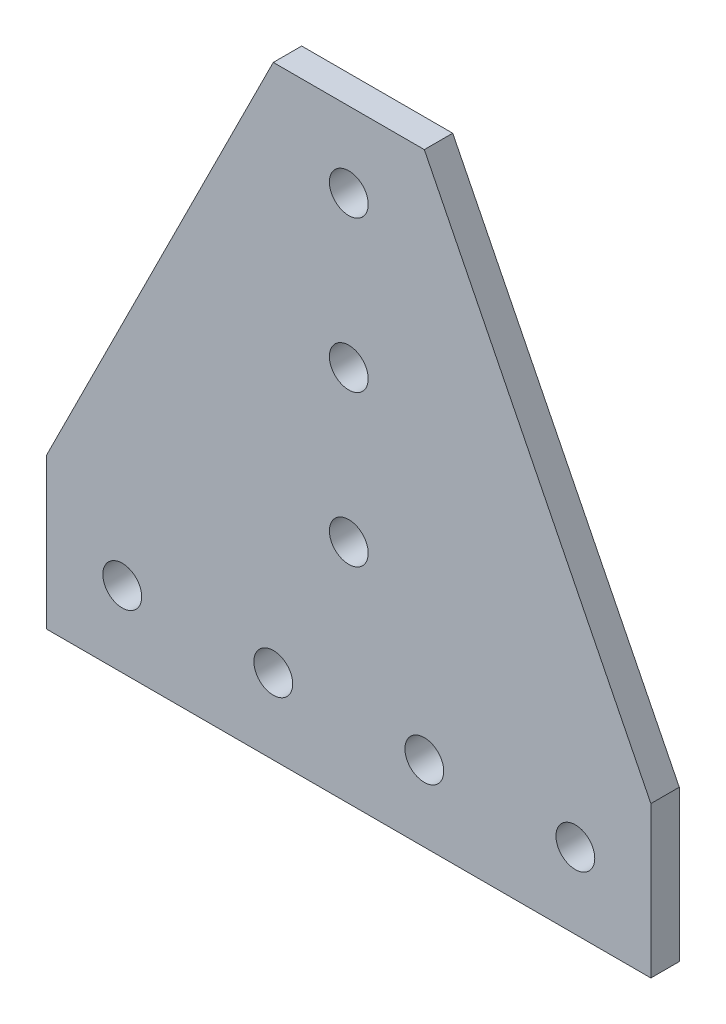
from build123d import *

# Parameters (mm, degrees)
BOSS_EXTRUDE1_DEPTH      = 2.3876
BOSS_EXTRUDE1_DEPTH_BACK = 2.3876
SKETCH4_R                = 3.2639
CUT_EXTRUDE1_DEPTH       = 73.000573158


with BuildPart() as part:
    # Sketch3 → Boss-Extrude1 (new, two sides: drawn at the far end of the back side and taken through both)
    with BuildSketch(Plane.XY.offset(-BOSS_EXTRUDE1_DEPTH_BACK)):
        Polygon((50.8, -50.8), (-50.8, -50.8), (-50.8, -25.4), (-12.7, 50.8), (12.7, 50.8), (50.8, -25.4), align=None)
    extrude(amount=BOSS_EXTRUDE1_DEPTH + BOSS_EXTRUDE1_DEPTH_BACK)

    # Sketch4 → Cut-Extrude1 (cut, through all)
    with BuildSketch(Plane.XY.offset(2.3876)):
        with Locations((-38.1, -38.1)):
            Circle(SKETCH4_R)
        with Locations((-12.7, -38.1)):
            Circle(SKETCH4_R)
        with Locations((12.7, -38.1)):
            Circle(SKETCH4_R)
        with Locations((0, 38.1)):
            Circle(SKETCH4_R)
        with Locations((0, 12.7)):
            Circle(SKETCH4_R)
        with Locations((38.1, -38.1)):
            Circle(SKETCH4_R)
        with Locations((0, -12.7)):
            Circle(SKETCH4_R)
    extrude(amount=-CUT_EXTRUDE1_DEPTH, mode=Mode.SUBTRACT)


solid = part.part
